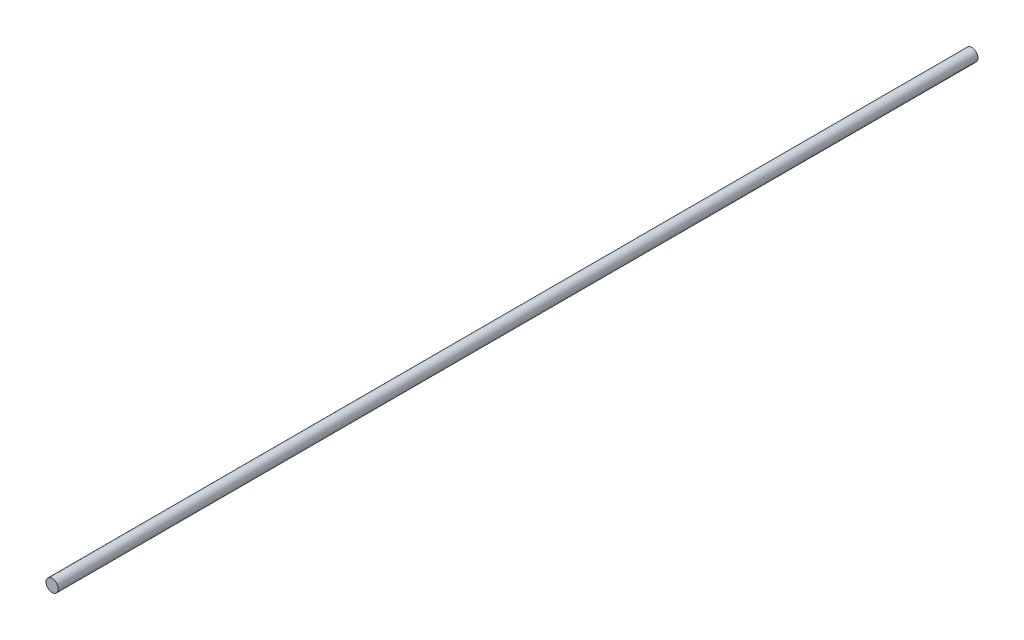
from build123d import *

# Parameters (mm, degrees)
EXTRUDE_1_DEPTH      = 1480
EXTRUDE_1_DEPTH_BACK = 20
SKETCH_1_R           = 10


with BuildPart() as part:
    # Эскиз1 → Бобышка-Вытянуть1 (new, two sides: drawn at the far end of the back side and taken through both)
    with BuildSketch(Plane.XY.offset(-EXTRUDE_1_DEPTH_BACK)):
        Circle(SKETCH_1_R)
    extrude(amount=EXTRUDE_1_DEPTH + EXTRUDE_1_DEPTH_BACK)


solid = part.part
